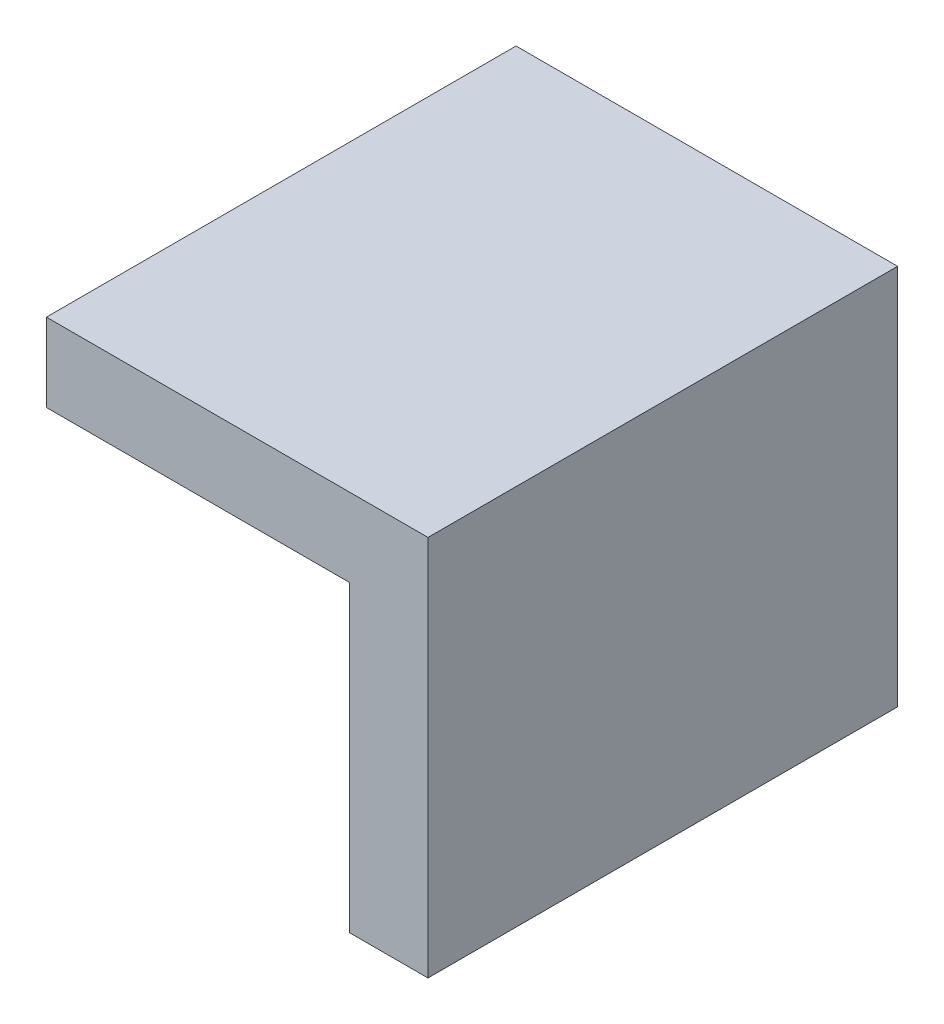
from build123d import *

# Parameters (mm, degrees)
SKETCH_1_W          = 7.8
SKETCH_1_H          = 7.8
EXTRUDE_1_DEPTH     = 9.6
SKETCH_6_W          = 6.2
SKETCH_6_H          = 6.2
CUT_EXTRUDE_8_DEPTH = 7.6
SKETCH_9_R          = 2.5
CUT_EXTRUDE_9_DEPTH = 1.8


with BuildPart() as part:
    # Эскиз1 → Бобышка-Вытянуть1 (new body)
    with BuildSketch(Plane.XY):
        Rectangle(SKETCH_1_W, SKETCH_1_H)
    extrude(amount=EXTRUDE_1_DEPTH)

    # Эскиз6 → Вырез-Вытянуть8 (cut)
    with BuildSketch(Plane.XY.offset(9.6)):
        with Locations((-0.8, -0.8)):
            Rectangle(SKETCH_6_W, SKETCH_6_H)
    extrude(amount=-CUT_EXTRUDE_8_DEPTH, mode=Mode.SUBTRACT)

    # Эскиз9 → Вырез-Вытянуть9 (cut)
    with BuildSketch(Plane(origin=(0, 0, 0), x_dir=(-1, 0, 0), z_dir=(0, 0, -1))):
        Circle(SKETCH_9_R)
    extrude(amount=-CUT_EXTRUDE_9_DEPTH, mode=Mode.SUBTRACT)


solid = part.part
